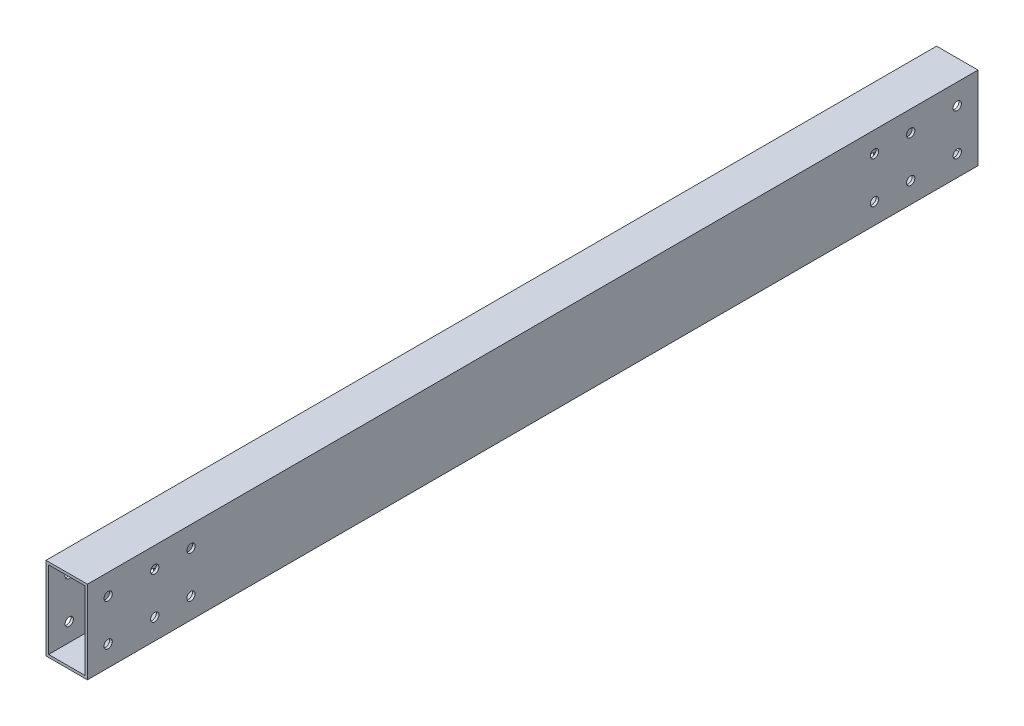
from build123d import *

# Parameters (mm, degrees)
SKETCH1_W           = 25.4
SKETCH1_H           = 50.8
SKETCH1_W_2         = 22.225
SKETCH1_H_2         = 47.625
BOSS_EXTRUDE1_DEPTH = 546.1
SKETCH2_R           = 2.54
CUT_EXTRUDE1_DEPTH  = 550.045544559


with BuildPart() as part:
    # Sketch1 → Boss-Extrude1 (new body)
    with BuildSketch(Plane.XY):
        with Locations((12.7, 25.4)):
            Rectangle(SKETCH1_W, SKETCH1_H)
        with Locations((12.7, 25.4)):
            Rectangle(SKETCH1_W_2, SKETCH1_H_2, mode=Mode.SUBTRACT)
    extrude(amount=BOSS_EXTRUDE1_DEPTH)

    # Sketch2 → Cut-Extrude1 (cut, through all)
    with BuildSketch(Plane(origin=(25.4, 0, 0), x_dir=(0, 0, -1), z_dir=(1, 0, 0))):
        with Locations((-504.825, 38.1)):
            Circle(SKETCH2_R)
        with Locations((-504.825, 12.7)):
            Circle(SKETCH2_R)
        with Locations((-482.6, 38.1)):
            Circle(SKETCH2_R)
        with Locations((-482.6, 12.7)):
            Circle(SKETCH2_R)
        with Locations((-533.4, 12.7)):
            Circle(SKETCH2_R)
        with Locations((-533.4, 38.1)):
            Circle(SKETCH2_R)
        with Locations(Location((-12.7, 38.1, 0), (0, 0, 180))):
            Circle(SKETCH2_R)
        with Locations(Location((-12.7, 12.7, 0), (0, 0, 180))):
            Circle(SKETCH2_R)
        with Locations(Location((-63.5, 12.7, 0), (0, 0, 180))):
            Circle(SKETCH2_R)
        with Locations(Location((-63.5, 38.1, 0), (0, 0, 180))):
            Circle(SKETCH2_R)
        with Locations(Location((-41.275, 12.7, 0), (0, 0, 180))):
            Circle(SKETCH2_R)
        with Locations(Location((-41.275, 38.1, 0), (0, 0, 180))):
            Circle(SKETCH2_R)
    extrude(amount=-CUT_EXTRUDE1_DEPTH, mode=Mode.SUBTRACT)


solid = part.part
